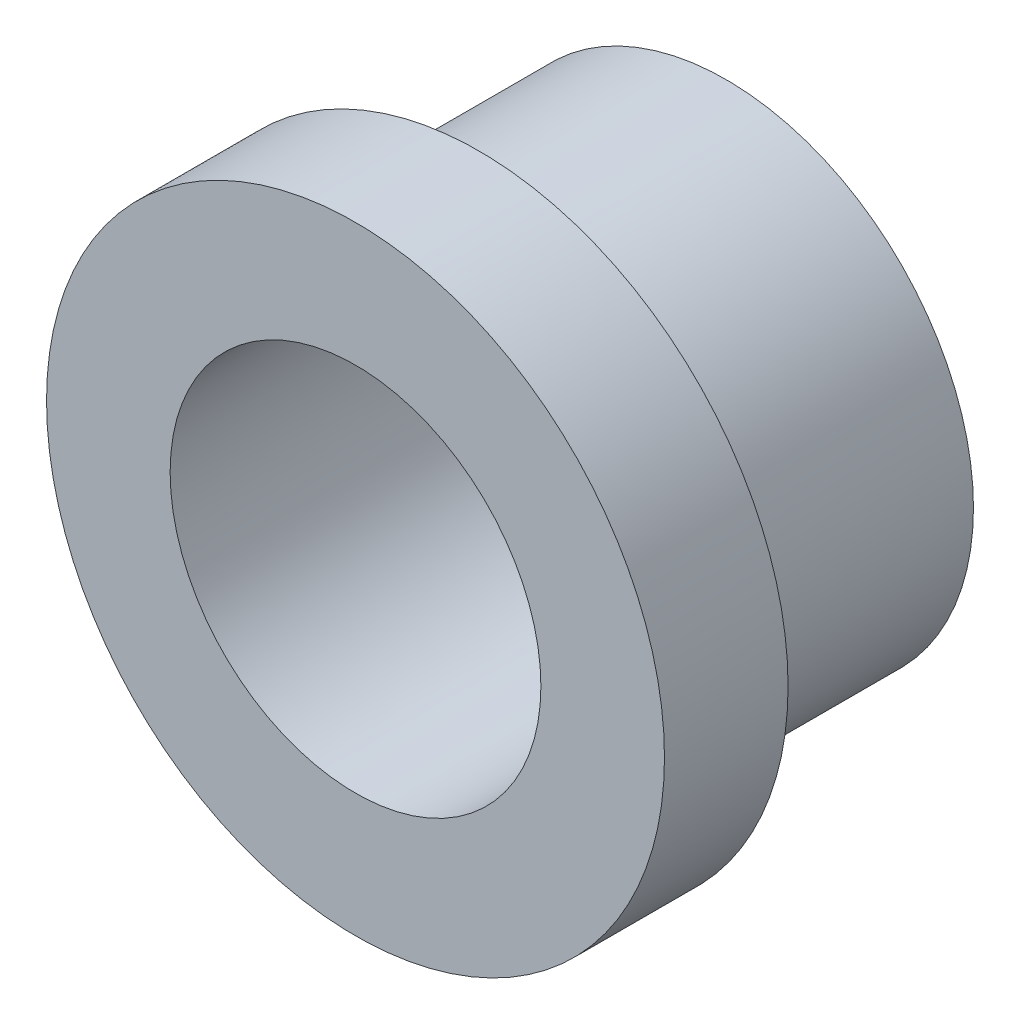
from build123d import *


with BuildPart() as part:
    # Sketch1 → Revolve1 (revolve)
    with BuildSketch(Plane(origin=(0, 0, 0), x_dir=(0, 0, -1), z_dir=(1, 0, 0)), mode=Mode.PRIVATE) as revolve1_sk:
        Polygon((0, 7.9375), (3.175, 7.9375), (3.175, 6.35), (9.525, 6.35), (9.525, 4.7625), (0, 4.7625), align=None)
    revolve(revolve1_sk.sketch.rotate(Axis((0, 0, 0), (0, 0, -1)), 90), axis=Axis((0, 0, 0), (0, 0, -1)))


solid = part.part
